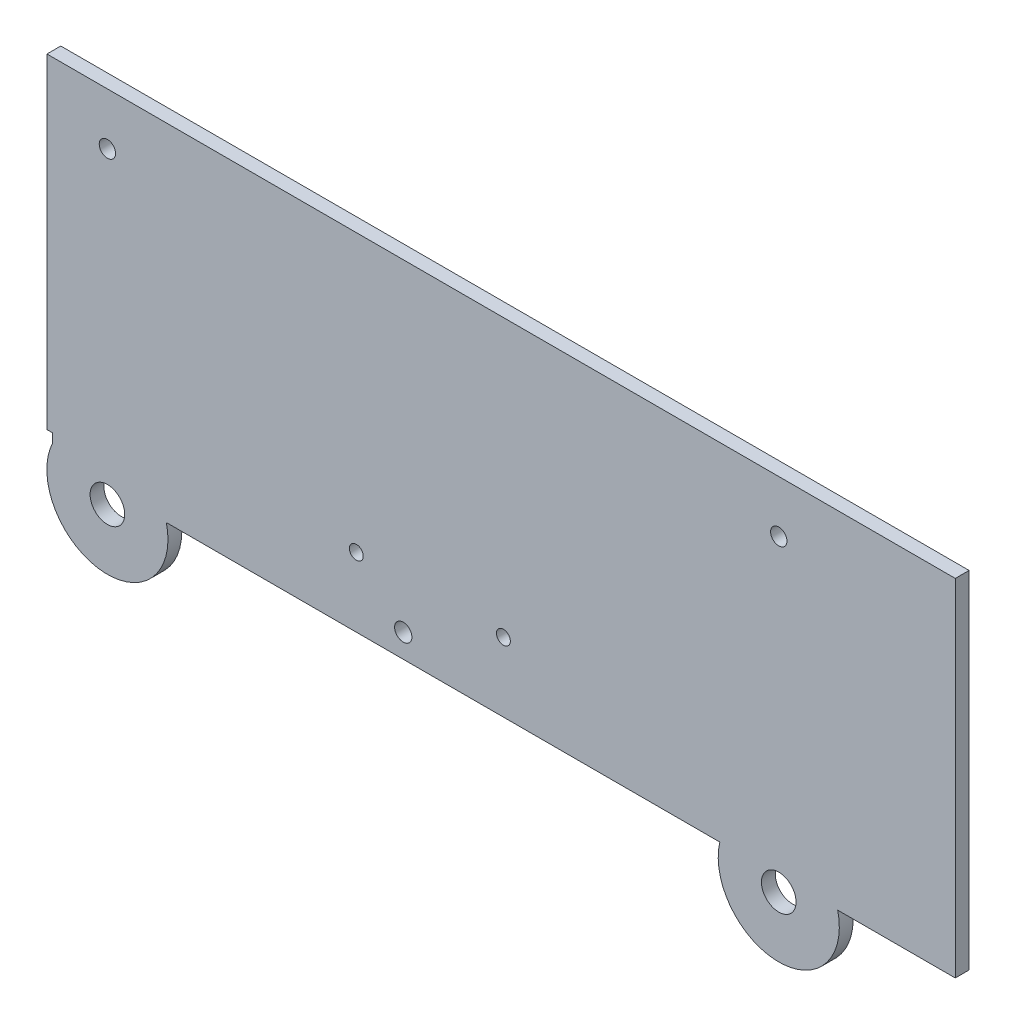
from build123d import *

# Parameters (mm, degrees)
BOSS_EXTRUDE1_DEPTH = 5.07492
SKETCH5_W           = 44.45
SKETCH5_H           = 127
BOSS_EXTRUDE2_DEPTH = 5.07492
SKETCH6_R           = 22.225
BOSS_EXTRUDE3_DEPTH = 5.07492
SKETCH2_3_R         = 6.35
CUT_EXTRUDE2_DEPTH  = 5.588
SKETCH8_W           = 2.728150378
SKETCH8_H           = 119.38
BOSS_EXTRUDE4_DEPTH = 5.07492
SKETCH9_R           = 3
CUT_EXTRUDE3_DEPTH  = 400.05
SKETCH10_R          = 2.54
SKETCH10_R_2        = 3.175
CUT_EXTRUDE4_DEPTH  = 6.35


with BuildPart() as part:
    # Sketch2 → Boss-Extrude1 (new body)
    with BuildSketch(Plane.XY):
        with BuildLine():
            Line((-143.383, -31.75), (-127.127, -31.75))
            ThreePointArc((-127.127, -31.75), (-123.317, -30.48), (-119.507, -31.75))
            Line((-119.507, -31.75), (119.253, -31.75))
            ThreePointArc((119.253, -31.75), (123.063, -30.48), (126.873, -31.75))
            Line((126.873, -31.75), (143.383, -31.75))
            Line((143.383, -31.75), (143.383, 95.25))
            Line((143.383, 95.25), (-143.383, 95.25))
            Line((-143.383, 95.25), (-143.383, -31.75))
        make_face()
    extrude(amount=-BOSS_EXTRUDE1_DEPTH)

    # Sketch5 → Boss-Extrude2 (add)
    with BuildSketch(Plane(origin=(0, 0, -5.07492), x_dir=(-1, 0, 0), z_dir=(0, 0, -1))):
        with Locations((-165.608, 31.75)):
            Rectangle(SKETCH5_W, SKETCH5_H)
    extrude(amount=-BOSS_EXTRUDE2_DEPTH)

    # Sketch6 → Boss-Extrude3 (add)
    with BuildSketch(Plane(origin=(0, 0, -5.07492), x_dir=(-1, 0, 0), z_dir=(0, 0, -1))):
        with Locations((-123.063, -36.83)):
            Circle(SKETCH6_R)
        with Locations((123.317, -36.83)):
            Circle(SKETCH6_R)
    extrude(amount=-BOSS_EXTRUDE3_DEPTH)

    # Sketch2<3> → Cut-Extrude2 (cut)
    with BuildSketch(Plane.XY):
        with Locations((-123.317, -36.83)):
            Circle(SKETCH2_3_R)
        with Locations((123.063, -36.83)):
            Circle(SKETCH2_3_R)
    extrude(amount=-CUT_EXTRUDE2_DEPTH, mode=Mode.SUBTRACT)

    # Sketch8 → Boss-Extrude4 (add)
    with BuildSketch(Plane(origin=(0, 0, -5.07492), x_dir=(-1, 0, 0), z_dir=(0, 0, -1))):
        with Locations((144.139824811, 35.56)):
            Rectangle(SKETCH8_W, SKETCH8_H)
    extrude(amount=-BOSS_EXTRUDE4_DEPTH)

    # Sketch9 → Cut-Extrude3 (cut)
    with BuildSketch(Plane(origin=(0, 0, -5.07492), x_dir=(-1, 0, 0), z_dir=(0, 0, -1))):
        with Locations((-123.063, 76.2)):
            Circle(SKETCH9_R)
        with Locations((123.317, 76.2)):
            Circle(SKETCH9_R)
    extrude(amount=-CUT_EXTRUDE3_DEPTH, mode=Mode.SUBTRACT)

    # Sketch10 → Cut-Extrude4 (cut)
    with BuildSketch(Plane(origin=(0, 0, -5.07492), x_dir=(-1, 0, 0), z_dir=(0, 0, -1))):
        with Locations((-22.0091, -6.35)):
            Circle(SKETCH10_R)
        with Locations((14.745829779, -23.114)):
            Circle(SKETCH10_R_2)
        with Locations((31.9659, -6.35)):
            Circle(SKETCH10_R)
    extrude(amount=-CUT_EXTRUDE4_DEPTH, mode=Mode.SUBTRACT)


solid = part.part
